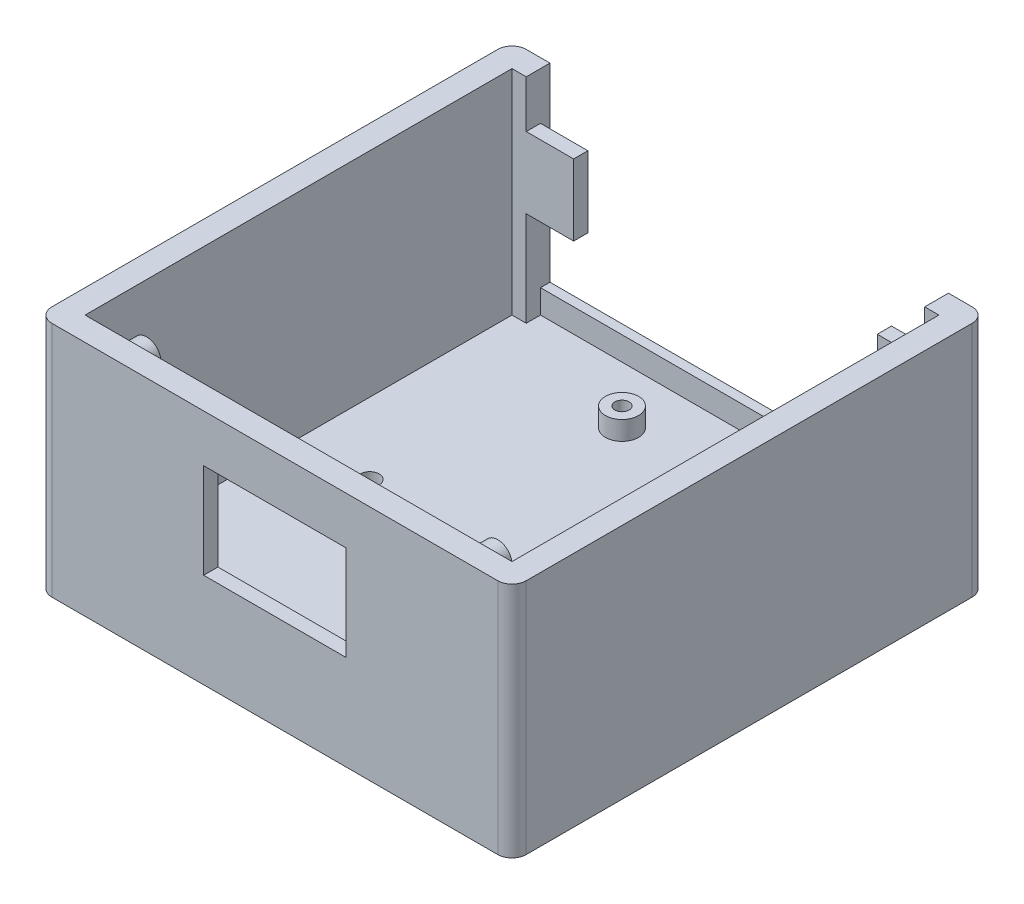
from build123d import *

# Parameters (mm, degrees)
EXTRUDE_355_DEPTH      = 50
SKETCH_2_W             = 90
SKETCH_2_H             = 90
CUT_EXTRUDE_705_DEPTH  = 45
SKETCH_3_R             = 3.5
SKETCH_3_R_2           = 1.5
TYPE_C_DEPTH           = 4
TYPE_C_START           = -2
SKETCH_3_2_R           = 1.5
TYPE_C_2_DEPTH         = 2
SKETCH_4_W             = 36.625
SKETCH_4_H             = 10
TYPE_C_3_DEPTH         = 3
SKETCH_5_W             = 10
SKETCH_5_H             = 5
TYPE_C_4_DEPTH         = 2
SKETCH_6_R             = 3
SKETCH_6_R_2           = 1.5
EXTRUDE_2034_DEPTH     = 5
SKETCH_7_W             = 30
SKETCH_7_H             = 20
OLED_DEPTH             = 5
SKETCH_8_W             = 44
SKETCH_8_H             = 34
OLED_2_DEPTH           = 2
SKETCH_9_R             = 4
SKETCH_9_R_2           = 2
CUT_EXTRUDE_2931_DEPTH = 2.5
SKETCH_9_2_R           = 2
CUT_EXTRUDE_2975_DEPTH = 5
SKETCH_10_W            = 84
SKETCH_10_H            = 40
CUT_EXTRUDE_9_DEPTH    = 5
SKETCH_11_W            = 23.6875
SKETCH_11_H            = 3
CUT_EXTRUDE_10_DEPTH   = 2
SKETCH_12_W            = 84
SKETCH_12_H            = 3
CUT_EXTRUDE_11_DEPTH   = 3
SKETCH_14_W            = 10
SKETCH_14_H            = 3
EXTRUDE_1_DEPTH        = 25
SKETCH_14_2_W          = 10
SKETCH_14_2_H          = 3
CUT_EXTRUDE_12_DEPTH   = 10


with BuildPart() as part:
    # 草图1 → Extrude 355 (new body)
    with BuildSketch(Plane(origin=(0, 0, 0), x_dir=(1, 0, 0), z_dir=(0, 1, 0))):
        with BuildLine():
            Line((3, 0), (97, 0))
            ThreePointArc((97, 0), (99.121320344, 0.878679656), (100, 3))
            Line((100, 3), (100, 97))
            ThreePointArc((100, 97), (99.121320344, 99.121320344), (97, 100))
            Line((97, 100), (3, 100))
            ThreePointArc((3, 100), (0.878679656, 99.121320344), (0, 97))
            Line((0, 97), (0, 3))
            ThreePointArc((0, 3), (0.878679656, 0.878679656), (3, 0))
        make_face()
    extrude(amount=EXTRUDE_355_DEPTH)

    # 草图2 → Cut-Extrude 705 (cut)
    with BuildSketch(Plane(origin=(0, 50, 0), x_dir=(1, 0, 0), z_dir=(0, 1, 0))):
        with Locations((50, 50)):
            Rectangle(SKETCH_2_W, SKETCH_2_H)
    extrude(amount=-CUT_EXTRUDE_705_DEPTH, mode=Mode.SUBTRACT)

    # 草图3 → TYPE-C (add)
    # profile 1 of 2: a face of its own
    with BuildSketch(Plane(origin=(0, 5, 0), x_dir=(1, 0, 0), z_dir=(0, 1, 0))):
        with Locations(Location((37.1875, 86, 0), (0, 0, 90))):
            Circle(SKETCH_3_R)
        with Locations(Location((37.1875, 86, 0), (0, 0, 270))):
            Circle(SKETCH_3_R_2, mode=Mode.SUBTRACT)
    # profile 2 of 2: a face of its own
    with BuildSketch(Plane(origin=(0, 5, 0), x_dir=(1, 0, 0), z_dir=(0, 1, 0))):
        with Locations(Location((62.8125, 86, 0), (0, 0, 90))):
            Circle(SKETCH_3_R)
        with Locations(Location((62.8125, 86, 0), (0, 0, 270))):
            Circle(SKETCH_3_R_2, mode=Mode.SUBTRACT)
    extrude(amount=TYPE_C_DEPTH)

    # 草图3<2> → TYPE-C 2 (cut)
    with BuildSketch(Plane(origin=(0, 5, 0), x_dir=(1, 0, 0), z_dir=(0, 1, 0)).offset(TYPE_C_START)):
        with Locations(Location((37.1875, 86, 0), (0, 0, 270))):
            Circle(SKETCH_3_2_R)
        with Locations(Location((62.8125, 86, 0), (0, 0, 270))):
            Circle(SKETCH_3_2_R)
    extrude(amount=TYPE_C_2_DEPTH, mode=Mode.SUBTRACT)

    # 草图4 → TYPE-C 3 (cut)
    with BuildSketch(Plane.XY.offset(-95)):
        with Locations((50, 13)):
            Rectangle(SKETCH_4_W, SKETCH_4_H)
    extrude(amount=-TYPE_C_3_DEPTH, mode=Mode.SUBTRACT)

    # 草图5 → TYPE-C 4 (cut)
    with BuildSketch(Plane.XY.offset(-98)):
        with Locations((50, 12.5)):
            Rectangle(SKETCH_5_W, SKETCH_5_H)
    extrude(amount=-TYPE_C_4_DEPTH, mode=Mode.SUBTRACT)

    # 草图6 → Extrude 2034 (add)
    # profile 1 of 4: a face of its own
    with BuildSketch(Plane(origin=(0, 0, -5), x_dir=(-1, 0, 0), z_dir=(0, 0, -1))):
        with Locations(Location((-87, 44.5, 0), (0, 0, 180))):
            Circle(SKETCH_6_R)
        with Locations((-87, 44.5)):
            Circle(SKETCH_6_R_2, mode=Mode.SUBTRACT)
    # profile 2 of 4: a face of its own
    with BuildSketch(Plane(origin=(0, 0, -5), x_dir=(-1, 0, 0), z_dir=(0, 0, -1))):
        with Locations(Location((-87, 24.5, 0), (0, 0, 180))):
            Circle(SKETCH_6_R)
        with Locations((-87, 24.5)):
            Circle(SKETCH_6_R_2, mode=Mode.SUBTRACT)
    # profile 3 of 4: a face of its own
    with BuildSketch(Plane(origin=(0, 0, -5), x_dir=(-1, 0, 0), z_dir=(0, 0, -1))):
        with Locations(Location((-13, 44.5, 0), (0, 0, 180))):
            Circle(SKETCH_6_R)
        with Locations((-13, 44.5)):
            Circle(SKETCH_6_R_2, mode=Mode.SUBTRACT)
    # profile 4 of 4: a face of its own
    with BuildSketch(Plane(origin=(0, 0, -5), x_dir=(-1, 0, 0), z_dir=(0, 0, -1))):
        with Locations(Location((-13, 10.5, 0), (0, 0, 180))):
            Circle(SKETCH_6_R)
        with Locations((-13, 10.5)):
            Circle(SKETCH_6_R_2, mode=Mode.SUBTRACT)
    extrude(amount=EXTRUDE_2034_DEPTH)

    # 草图7 → OLED (cut)
    with BuildSketch(Plane.XY):
        with Locations((50, 30)):
            Rectangle(SKETCH_7_W, SKETCH_7_H)
    extrude(amount=-OLED_DEPTH, mode=Mode.SUBTRACT)

    # 草图8 → OLED 2 (cut)
    with BuildSketch(Plane(origin=(0, 0, -5), x_dir=(-1, 0, 0), z_dir=(0, 0, -1))):
        with Locations((-50, 30)):
            Rectangle(SKETCH_8_W, SKETCH_8_H)
    extrude(amount=-OLED_2_DEPTH, mode=Mode.SUBTRACT)

    # 草图9 → Cut-Extrude 2931 (cut)
    # profile 1 of 2: a face of its own
    with BuildSketch(Plane.XZ):
        with Locations(Location((80, -50, 0), (0, 0, 270))):
            Circle(SKETCH_9_R)
        with Locations(Location((80, -50, 0), (0, 0, 270))):
            Circle(SKETCH_9_R_2, mode=Mode.SUBTRACT)
    # profile 2 of 2: a face of its own
    with BuildSketch(Plane.XZ):
        with Locations(Location((20, -50, 0), (0, 0, 270))):
            Circle(SKETCH_9_R)
        with Locations(Location((20, -50, 0), (0, 0, 270))):
            Circle(SKETCH_9_R_2, mode=Mode.SUBTRACT)
    extrude(amount=-CUT_EXTRUDE_2931_DEPTH, mode=Mode.SUBTRACT)

    # 草图9<2> → Cut-Extrude 2975 (cut)
    with BuildSketch(Plane.XZ):
        with Locations(Location((80, -50, 0), (0, 0, 270))):
            Circle(SKETCH_9_2_R)
        with Locations(Location((20, -50, 0), (0, 0, 270))):
            Circle(SKETCH_9_2_R)
    extrude(amount=-CUT_EXTRUDE_2975_DEPTH, mode=Mode.SUBTRACT)

    # 草图10 → 切除-拉伸9 (cut)
    with BuildSketch(Plane(origin=(0, 0, -100), x_dir=(-1, 0, 0), z_dir=(0, 0, -1))):
        with Locations((-50, 30)):
            Rectangle(SKETCH_10_W, SKETCH_10_H)
    extrude(amount=-CUT_EXTRUDE_9_DEPTH, mode=Mode.SUBTRACT)

    # 草图11 → 切除-拉伸10 (cut)
    with BuildSketch(Plane(origin=(0, 10, 0), x_dir=(1, 0, 0), z_dir=(0, 1, 0))):
        with Locations((80.15625, 96.5)):
            Rectangle(SKETCH_11_W, SKETCH_11_H)
        with Locations((19.84375, 96.5)):
            Rectangle(SKETCH_11_W, SKETCH_11_H)
    extrude(amount=-CUT_EXTRUDE_10_DEPTH, mode=Mode.SUBTRACT)

    # 草图12 → 切除-拉伸11 (cut)
    with BuildSketch(Plane(origin=(0, 8, 0), x_dir=(1, 0, 0), z_dir=(0, 1, 0))):
        with Locations((50, 96.5)):
            Rectangle(SKETCH_12_W, SKETCH_12_H)
    extrude(amount=-CUT_EXTRUDE_11_DEPTH, mode=Mode.SUBTRACT)

    # 草图14 → 凸台-拉伸1 (add)
    with BuildSketch(Plane(origin=(0, 50, 0), x_dir=(1, 0, 0), z_dir=(0, 1, 0))):
        with Locations((13, 96.5)):
            Rectangle(SKETCH_14_W, SKETCH_14_H)
        with Locations((87, 96.5)):
            Rectangle(SKETCH_14_W, SKETCH_14_H)
    extrude(amount=-EXTRUDE_1_DEPTH)

    # 草图14<2> → 切除-拉伸12 (cut)
    with BuildSketch(Plane(origin=(0, 50, 0), x_dir=(1, 0, 0), z_dir=(0, 1, 0))):
        with Locations((13, 96.5)):
            Rectangle(SKETCH_14_2_W, SKETCH_14_2_H)
        with Locations((87, 96.5)):
            Rectangle(SKETCH_14_2_W, SKETCH_14_2_H)
    extrude(amount=-CUT_EXTRUDE_12_DEPTH, mode=Mode.SUBTRACT)


solid = part.part
